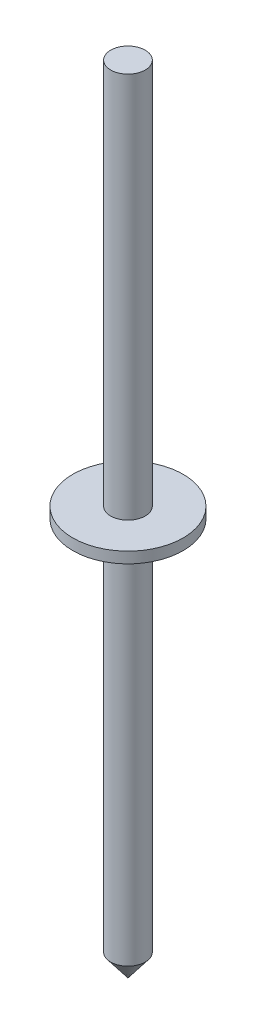
from build123d import *

# Parameters (mm, degrees)
SKETCH1_R           = 12.7
SKETCH1_R_2         = 3.96875
BOSS_EXTRUDE1_DEPTH = 2.54
BOSS_EXTRUDE2_START = -88.9
SKETCH2_R           = 3.96875
BOSS_EXTRUDE2_DEPTH = 177.8


with BuildPart() as part:
    # Sketch1 → Boss-Extrude1 (new body)
    with BuildSketch(Plane(origin=(0, 0, 0), x_dir=(1, 0, 0), z_dir=(0, 1, 0))):
        with Locations(Location((0, 0, 0), (0, 0, 270))):
            Circle(SKETCH1_R)
        with Locations(Location((0, 0, 0), (0, 0, 270))):
            Circle(SKETCH1_R_2, mode=Mode.SUBTRACT)
    extrude(amount=BOSS_EXTRUDE1_DEPTH)

    # Sketch2 → Boss-Extrude2 (add)
    with BuildSketch(Plane(origin=(0, 2.54, 0), x_dir=(1, 0, 0), z_dir=(0, 1, 0)).offset(BOSS_EXTRUDE2_START)):
        with Locations(Location((0, 0, 0), (0, 0, 270))):
            Circle(SKETCH2_R)
    extrude(amount=BOSS_EXTRUDE2_DEPTH)

    # Sketch3 → Revolve1 (revolve)
    with BuildSketch(Plane(origin=(0, 0, 0), x_dir=(0, 0, -1), z_dir=(1, 0, 0))):
        Polygon((0, -86.36), (-3.96875, -86.36), (0, -91.517208385), align=None)
    revolve(axis=Axis((0, -87.920610372, 0), (0, 1, 0)))


solid = part.part
